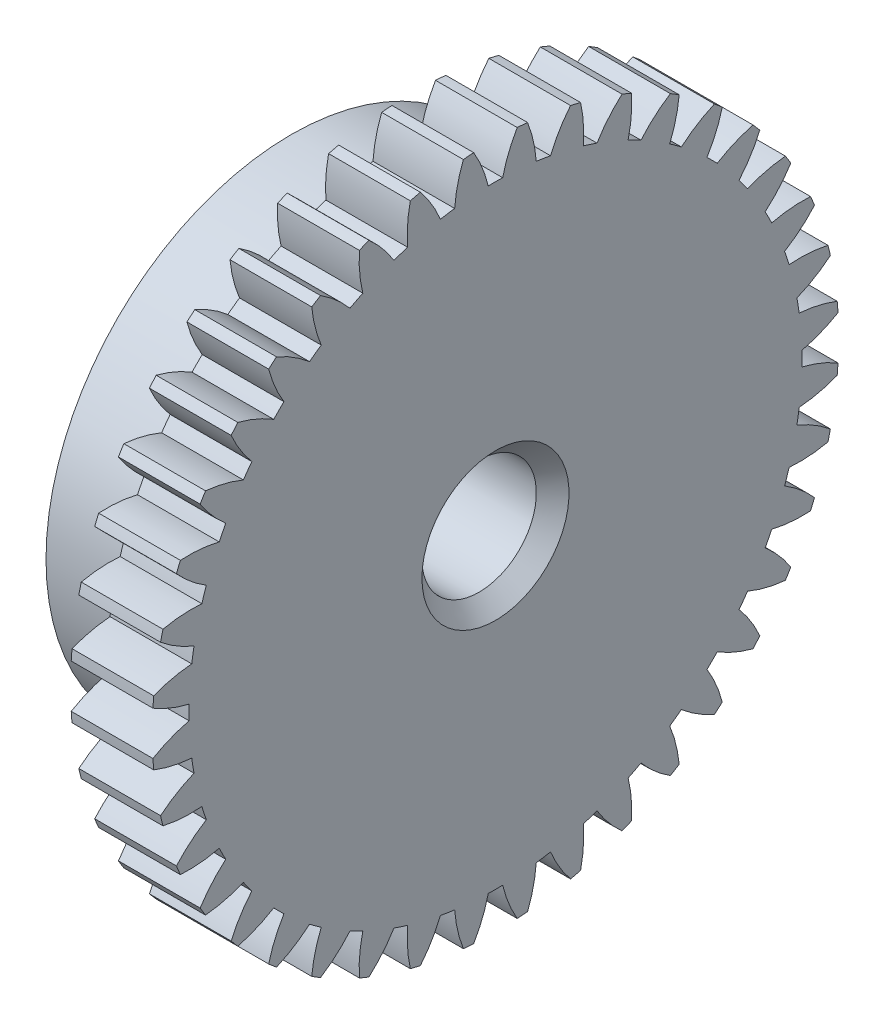
from build123d import *

# Parameters (mm, degrees)
BASPROSKE_W      = 10
BASPROSKE_H      = 42
TOOTHCUT_DEPTH   = 61.232881386
TEETHCUTS_COUNT  = 40
TEETHCUTS_ANGLE  = 351
HUBNEAONESKE_R   = 30
HUBNEARONE_DEPTH = 15.0000508
BORSKE_R         = 7
BORE_DEPTH       = 25.0000508
CHAMFER_1_SIZE   = 2


with BuildPart() as part:
    # BasProSke → Base-Revolve (revolve)
    with BuildSketch(Plane(origin=(0, 0, 0), x_dir=(1, 0, 0), z_dir=(0, 1, 0)), mode=Mode.PRIVATE) as base_revolve_sk:
        with Locations((5, 21)):
            Rectangle(BASPROSKE_W, BASPROSKE_H)
    revolve(base_revolve_sk.sketch.rotate(Axis((-10, 0, 0), (1, 0, 0)), 180), axis=Axis((-10, 0, 0), (1, 0, 0)))

    # TooCutSke → ToothCut (cut, through all)
    with BuildSketch(Plane(origin=(0, 0, 0), x_dir=(0, 0, -1), z_dir=(1, 0, 0))):
        with BuildLine():
            ThreePointArc((0.882812088, 37.488606854), (0, 37.499), (-0.882812088, 37.488606854))
            ThreePointArc((-0.882812088, 37.488606854), (-1.612748684, 39.782000434), (-2.678427154, 41.939960338))
            ThreePointArc((-2.678427154, 41.939960338), (0, 42.0254), (2.678427154, 41.939960338))
            ThreePointArc((2.678427154, 41.939960338), (1.612748684, 39.782000434), (0.882812088, 37.488606854))
        make_face()
    toothcut = extrude(amount=TOOTHCUT_DEPTH, mode=Mode.SUBTRACT)

    # TeethCuts: ToothCut ×40 about axis
    teethcuts_axis = Axis((-10, 0, 0), (1, 0, 0))
    for i in range(1, TEETHCUTS_COUNT):
        add(toothcut.rotate(teethcuts_axis, i * TEETHCUTS_ANGLE / (TEETHCUTS_COUNT - 1)), mode=Mode.SUBTRACT)

    # HubNeaOneSke → HubNearOne (add)
    with BuildSketch(Plane.ZY):
        with Locations(Location((0, 0, 0), (0, 0, 180))):
            Circle(HUBNEAONESKE_R)
    extrude(amount=HUBNEARONE_DEPTH)

    # BorSke → Bore (cut, symmetric)
    with BuildSketch(Plane(origin=(0, 0, 0), x_dir=(0, 0, -1), z_dir=(1, 0, 0))):
        with Locations(Location((0, 0, 0), (0, 0, 180))):
            Circle(BORSKE_R)
    extrude(amount=BORE_DEPTH, both=True, mode=Mode.SUBTRACT)

    # 倒角1
    chamfer_1_edges = [part.edges().sort_by_distance(p)[0] for p in [
        (-15.0000508, 0, -7),
        (10, 0, -7),
    ]]
    chamfer(chamfer_1_edges, length=CHAMFER_1_SIZE)


solid = part.part
